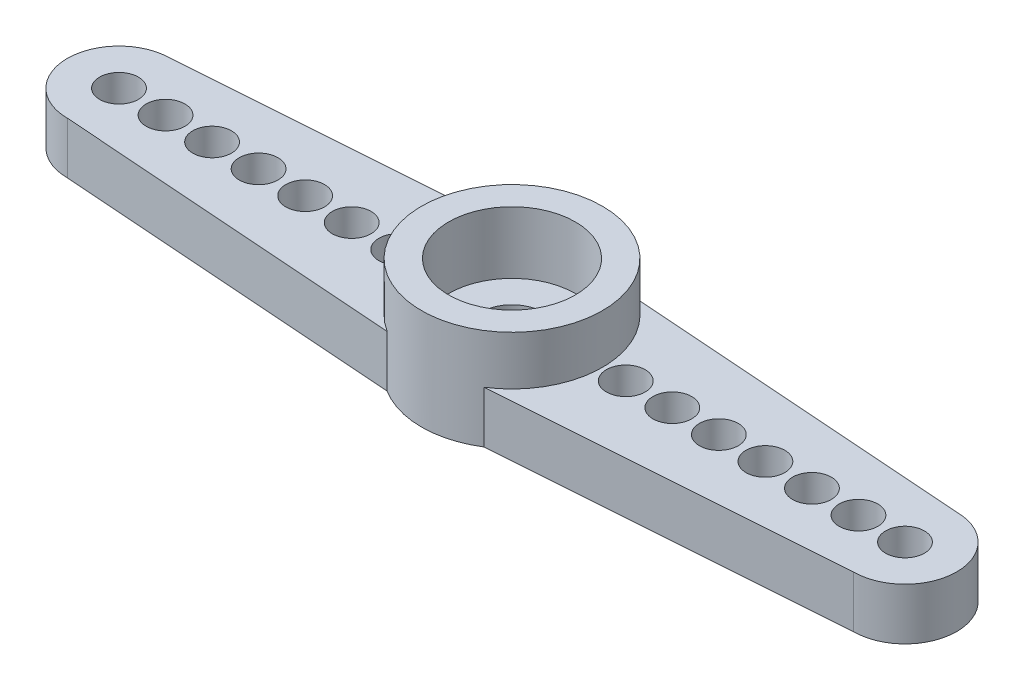
from build123d import *

# Parameters (mm, degrees)
SKETCH1_W             = 3.5
SKETCH1_H             = 3.9
BOSS_EXTRUDE1_START   = -2
BOSS_EXTRUDE1_DEPTH   = 2
BOSS_EXTRUDE2_START   = -2
BOSS_EXTRUDE2_DEPTH   = 2
F_1_5MM_DOWEL_HOLE1_D = 1.5


with BuildPart() as part:
    # Sketch1 → Revolve1 (revolve)
    with BuildSketch(Plane.XY, mode=Mode.PRIVATE) as revolve1_sk:
        with Locations((1.75, 1.95)):
            Rectangle(SKETCH1_W, SKETCH1_H)
    revolve(revolve1_sk.sketch.rotate(Axis((0, 3.9, 0), (0, -1, 0)), 270), axis=Axis((0, 3.9, 0), (0, -1, 0)))

    # Sketch2 → Boss-Extrude1 (add)
    with BuildSketch(Plane.XZ.offset(BOSS_EXTRUDE1_START)):
        with BuildLine():
            Line((-1.868584713, 2.959457918), (-15.2, 2))
            ThreePointArc((-15.2, 2), (-17.2, 0), (-15.2, -2))
            Line((-15.2, -2), (-1.868584713, -2.959457918))
            ThreePointArc((-1.868584713, -2.959457918), (-3.5, 0), (-1.868584713, 2.959457918))
        make_face()
    extrude(amount=BOSS_EXTRUDE1_DEPTH)

    # Sketch3 → Boss-Extrude2 (add)
    with BuildSketch(Plane.XZ.offset(BOSS_EXTRUDE2_START)):
        with BuildLine():
            Line((1.868584713, -2.959457918), (15.2, -2))
            ThreePointArc((15.2, -2), (17.2, 0), (15.2, 2))
            Line((15.2, 2), (1.868584713, 2.959457918))
            ThreePointArc((1.868584713, 2.959457918), (3.5, 0), (1.868584713, -2.959457918))
        make_face()
    extrude(amount=BOSS_EXTRUDE2_DEPTH)

    # Sketch4 → Cut-Revolve1 (revolve, cut)
    with BuildSketch(Plane.XY, mode=Mode.PRIVATE) as cut_revolve1_sk:
        Polygon((2.45, 3.9), (0, 3.9), (0, 0), (2.35, 0), (2.35, 1), (1.2, 1), (1.2, 1.5), (2.45, 1.5), align=None)
    revolve(cut_revolve1_sk.sketch.rotate(Axis((0, 3.9, 0), (0, -1, 0)), 270), axis=Axis((0, 3.9, 0), (0, -1, 0)), mode=Mode.SUBTRACT)

    # Ø1.5mm Dowel Hole1 (through all)
    with Locations(Plane(origin=(0, 0, 0), x_dir=(-1, 0, 0), z_dir=(0, -1, 0))):
        with Locations((15.2, 0), (-15.2, 0), (13.4, 0), (11.6, 0), (9.8, 0), (8, 0), (6.2, 0), (4.4, 0), (-13.4, 0), (-11.6, 0), (-9.8, 0), (-8, 0), (-6.2, 0), (-4.4, 0)):
            Hole(F_1_5MM_DOWEL_HOLE1_D / 2)


solid = part.part
